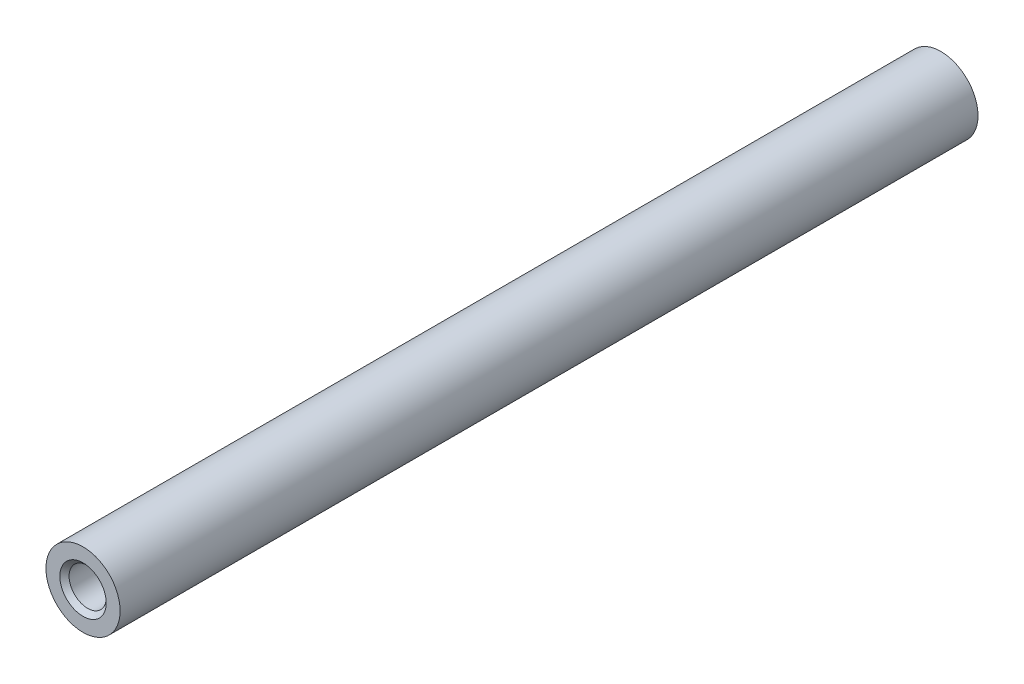
from build123d import *

# Parameters (mm, degrees)
SZKIC1_R                    = 8
SZKIC1_R_2                  = 4
DODANIE_WYCI_GNI_CIE1_DEPTH = 92.5
SZKIC2_R                    = 5
WYTNIJ_WYCI_GNI_CIE1_DEPTH  = 30
SFAZOWANIE1_SIZE            = 1


with BuildPart() as part:
    # Szkic1 → Dodanie-wyciągnięcie1 (new, symmetric)
    with BuildSketch(Plane.XY):
        Circle(SZKIC1_R)
        Circle(SZKIC1_R_2, mode=Mode.SUBTRACT)
    extrude(amount=DODANIE_WYCI_GNI_CIE1_DEPTH, both=True)

    # Szkic2 → Wytnij-wyciągnięcie1 (cut)
    with BuildSketch(Plane(origin=(0, 0, -92.5), x_dir=(-1, 0, 0), z_dir=(0, 0, -1))):
        Circle(SZKIC2_R)
    extrude(amount=-WYTNIJ_WYCI_GNI_CIE1_DEPTH, mode=Mode.SUBTRACT)

    # Sfazowanie1
    sfazowanie1_edges = [part.edges().sort_by_distance(p)[0] for p in [
        (-4, 0, 92.5),
    ]]
    chamfer(sfazowanie1_edges, length=SFAZOWANIE1_SIZE)


solid = part.part
